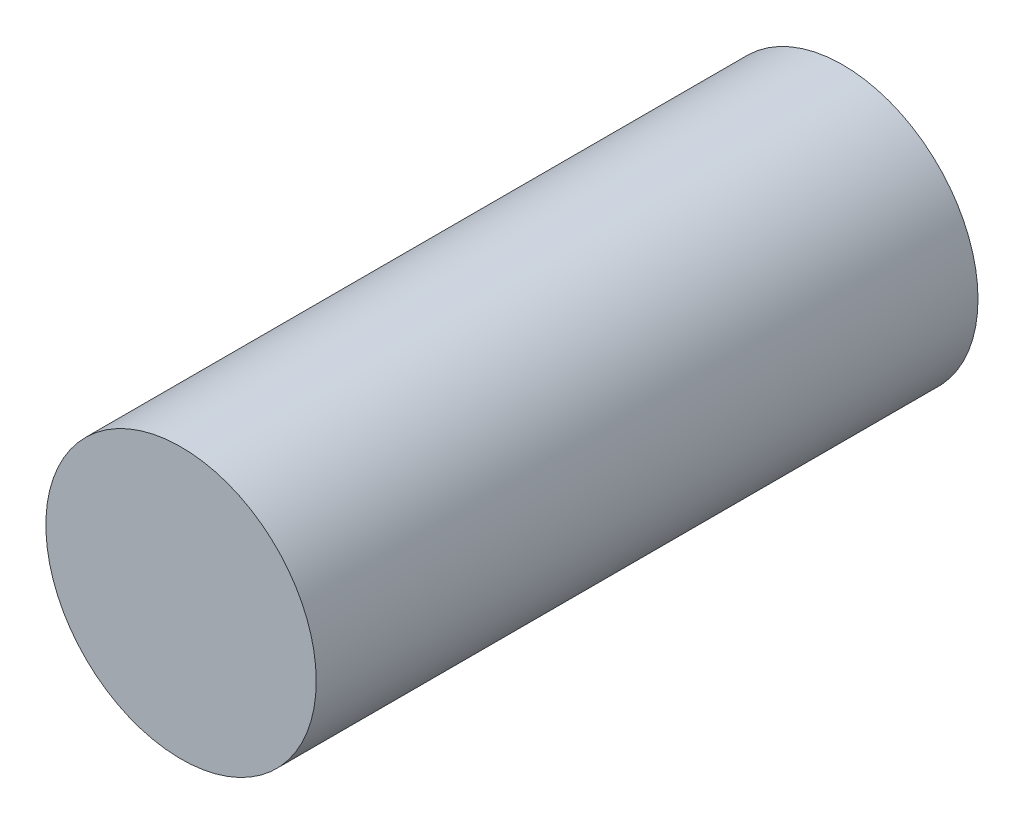
from build123d import *

# Parameters (mm, degrees)
SKETCH1_R           = 2.95
BOSS_EXTRUDE1_DEPTH = 14.44


with BuildPart() as part:
    # Sketch1 → Boss-Extrude1 (new body)
    with BuildSketch(Plane.XY):
        Circle(SKETCH1_R)
    extrude(amount=BOSS_EXTRUDE1_DEPTH)


solid = part.part
